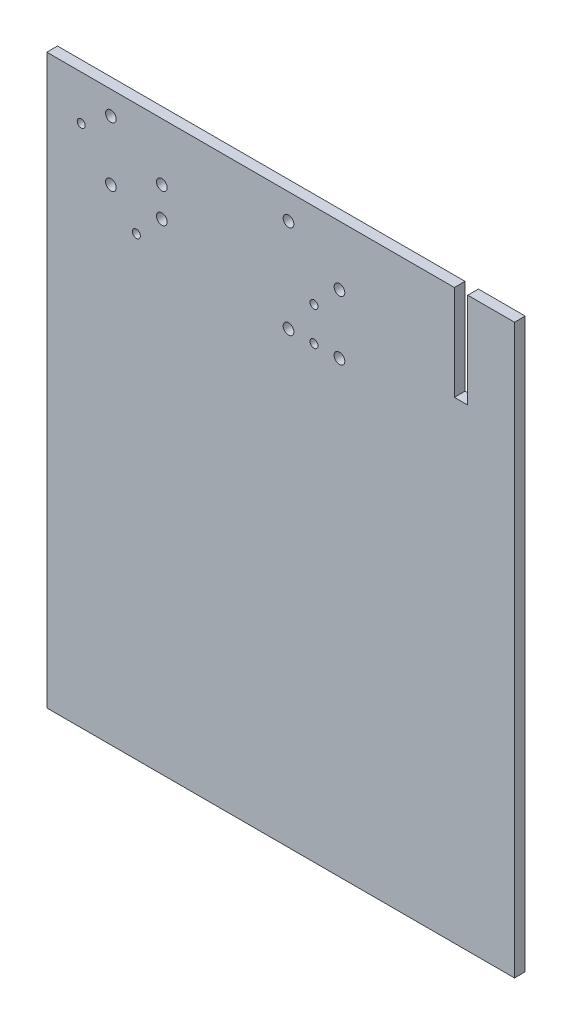
from build123d import *

# Parameters (mm, degrees)
BOSS_EXTRUDE1_DEPTH = 1.6
SKETCH2_R           = 0.6
SKETCH2_R_2         = 0.8
CUT_EXTRUDE1_DEPTH  = 56.08003268


with BuildPart() as part:
    # Sketch1 → Boss-Extrude1 (new body)
    with BuildSketch(Plane.XY):
        Polygon((28, 42.5), (28, 28.26), (26, 28.26), (26, 42.5), (-35, 42.5), (-35, -42.5), (35, -42.5), (35, 42.5), align=None)
    extrude(amount=BOSS_EXTRUDE1_DEPTH)

    # Sketch2 → Cut-Extrude1 (cut, through all)
    with BuildSketch(Plane.XY.offset(1.6)):
        with Locations((-21.595341155, 25.669496774)):
            Circle(SKETCH2_R)
        with Locations((-17.785341155, 29.484496774)):
            Circle(SKETCH2_R_2)
        with Locations((-25.405341155, 30.119496774)):
            Circle(SKETCH2_R_2)
        with Locations((-17.785341155, 33.929496774)):
            Circle(SKETCH2_R_2)
        with Locations((-25.405341155, 39.009496774)):
            Circle(SKETCH2_R_2)
        with Locations((-29.845341155, 35.839496774)):
            Circle(SKETCH2_R)
        with Locations((4.98804487, 24.719413951)):
            Circle(SKETCH2_R)
        with Locations((8.79804487, 24.719413951)):
            Circle(SKETCH2_R_2)
        with Locations((1.17804487, 24.719413951)):
            Circle(SKETCH2_R_2)
        with Locations((4.98804487, 29.799413951)):
            Circle(SKETCH2_R)
        with Locations((8.79804487, 33.609413951)):
            Circle(SKETCH2_R_2)
        with Locations((1.17804487, 38.689413951)):
            Circle(SKETCH2_R_2)
    extrude(amount=-CUT_EXTRUDE1_DEPTH, mode=Mode.SUBTRACT)


solid = part.part
